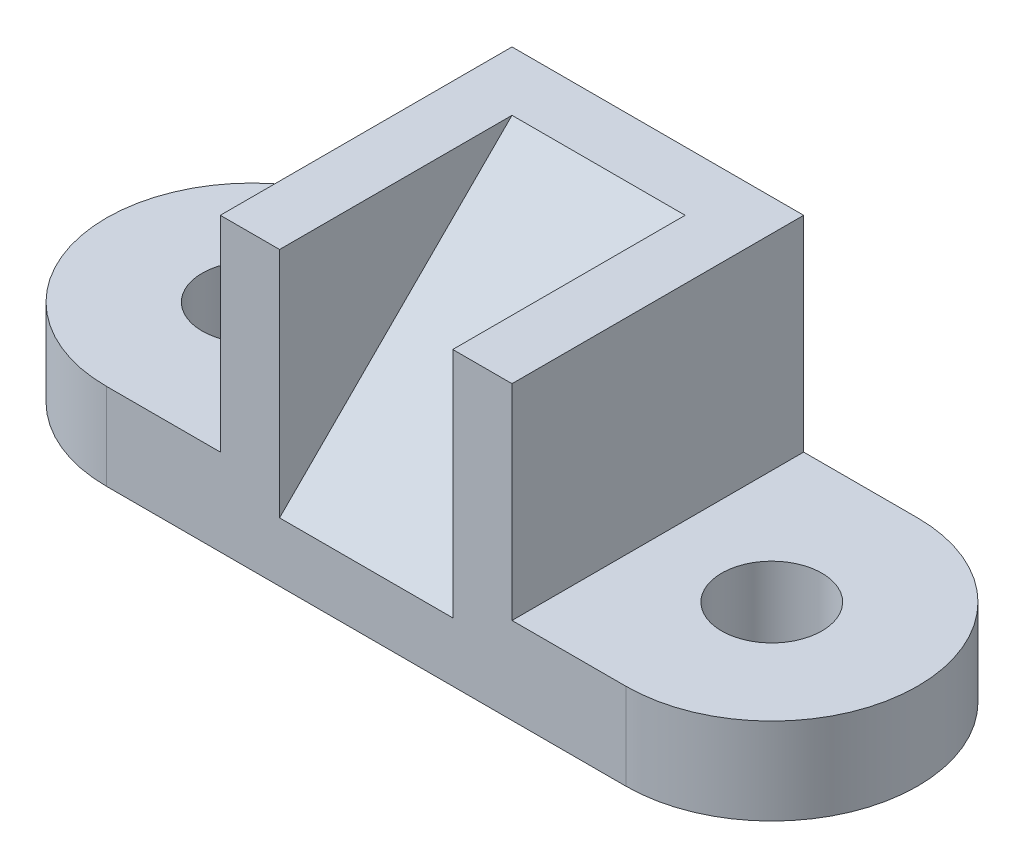
from build123d import *

# Parameters (mm, degrees)
SKETCH1_R               = 11
BOSS_EXTRUDE1_DEPTH     = 19
SKETCH2_W               = 64
SKETCH2_H               = 64
BOSS_EXTRUDE3_DEPTH     = 45
CUT_EXTRUDE1_DEPTH      = 115.197197864
CUT_EXTRUDE1_DEPTH_BACK = 51
SKETCH4_W               = 38
SKETCH4_H               = 51
BOSS_EXTRUDE4_REACH     = 131.553


with BuildPart() as part:
    # Sketch1 → Boss-Extrude1 (new body)
    with BuildSketch(Plane(origin=(0, 0, 0), x_dir=(1, 0, 0), z_dir=(0, 1, 0))):
        with BuildLine():
            Line((-57, 32), (57, 32))
            ThreePointArc((57, 32), (89, 0), (57, -32))
            Line((57, -32), (-57, -32))
            ThreePointArc((-57, -32), (-89, 0), (-57, 32))
        make_face()
        with Locations(Location((-57, 0, 0), (0, 0, 270))):
            Circle(SKETCH1_R, mode=Mode.SUBTRACT)
        with Locations(Location((57, 0, 0), (0, 0, 270))):
            Circle(SKETCH1_R, mode=Mode.SUBTRACT)
    extrude(amount=BOSS_EXTRUDE1_DEPTH)

    # Sketch2 → Boss-Extrude3 (add)
    with BuildSketch(Plane(origin=(0, 19, 0), x_dir=(1, 0, 0), z_dir=(0, 1, 0))):
        Rectangle(SKETCH2_W, SKETCH2_H)
    extrude(amount=BOSS_EXTRUDE3_DEPTH)

    # Sketch4 → Cut-Extrude1 (cut, two sides: drawn at the far end of the back side and taken through both)
    with BuildSketch(Plane(origin=(0, 64, 0), x_dir=(1, 0, 0), z_dir=(0, 1, 0)).offset(-CUT_EXTRUDE1_DEPTH_BACK)):
        with Locations((0, -6.5)):
            Rectangle(SKETCH4_W, SKETCH4_H)
    extrude(amount=CUT_EXTRUDE1_DEPTH + CUT_EXTRUDE1_DEPTH_BACK, mode=Mode.SUBTRACT)

    # Sketch5 → Boss-Extrude4 (add, up to next)
    with BuildSketch(Plane.ZY.offset(-19), mode=Mode.PRIVATE) as boss_extrude4_sk1:
        Polygon((-19, 64), (32, 13), (-19, 13), align=None)
    boss_extrude4_tool1 = extrude(boss_extrude4_sk1.sketch, amount=BOSS_EXTRUDE4_REACH, mode=Mode.PRIVATE) - part.part
    add(boss_extrude4_tool1.solids().sort_by_distance((19, 30, -2))[0])


solid = part.part
